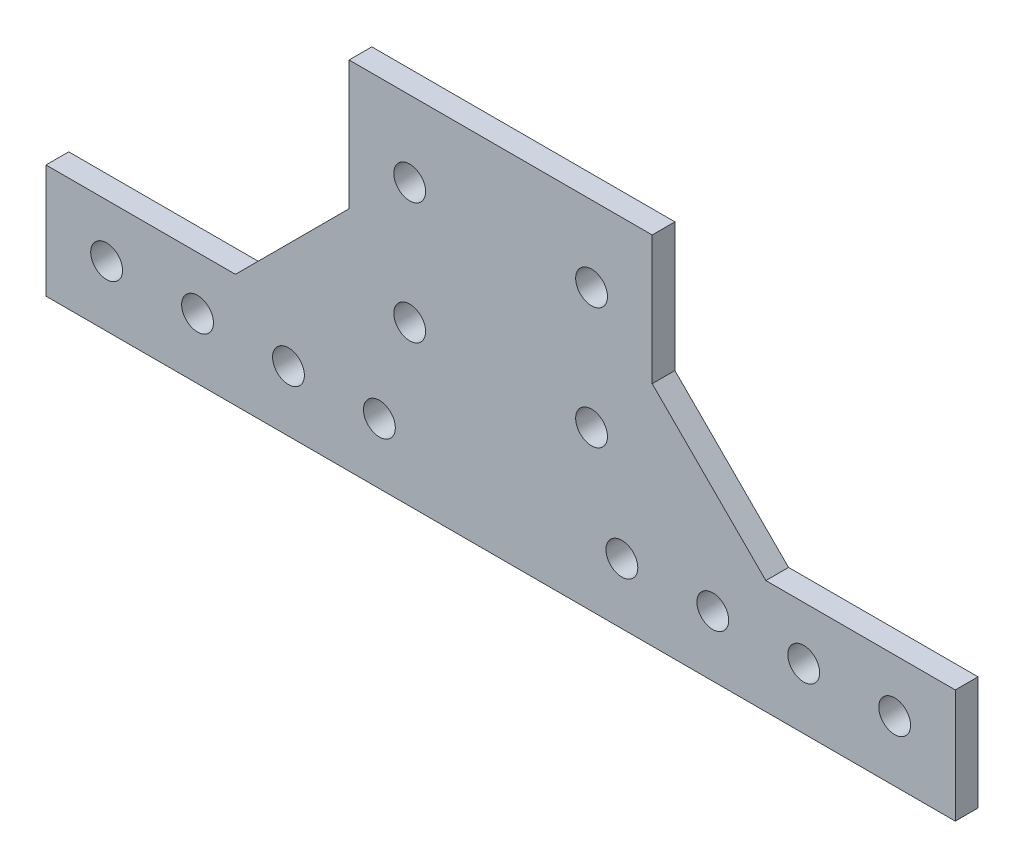
from build123d import *

# Parameters (mm, degrees)
EXTRUDE_1_DEPTH     = 3
SKETCH_2_R          = 2.1
CUT_EXTRUDE_1_DEPTH = 129.910821889


with BuildPart() as part:
    # 草图1 → 凸台-拉伸1 (new body)
    with BuildSketch(Plane.XY):
        Polygon((0, 0), (0, 15), (25, 15), (40, 30), (40, 47), (80, 47), (80, 30), (95, 15), (120, 15), (120, 0), align=None)
    extrude(amount=EXTRUDE_1_DEPTH)

    # 草图2 → 切除-拉伸1 (cut, through all)
    with BuildSketch(Plane.XY.offset(3)):
        with Locations((48, 37)):
            Circle(SKETCH_2_R)
        with Locations((72, 37)):
            Circle(SKETCH_2_R)
        with Locations((48, 21)):
            Circle(SKETCH_2_R)
        with Locations((72, 21)):
            Circle(SKETCH_2_R)
        with Locations((112, 8)):
            Circle(SKETCH_2_R)
        with Locations((76, 8)):
            Circle(SKETCH_2_R)
        with Locations((88, 8)):
            Circle(SKETCH_2_R)
        with Locations((8, 8)):
            Circle(SKETCH_2_R)
        with Locations((20, 8)):
            Circle(SKETCH_2_R)
        with Locations((100, 8)):
            Circle(SKETCH_2_R)
        with Locations((32, 8)):
            Circle(SKETCH_2_R)
        with Locations((44, 8)):
            Circle(SKETCH_2_R)
        with Locations((432, 8)):
            Circle(SKETCH_2_R)
        with Locations((444, 8)):
            Circle(SKETCH_2_R)
        with Locations((524, 8)):
            Circle(SKETCH_2_R)
        with Locations((536, 8)):
            Circle(SKETCH_2_R)
        with Locations((456, 8)):
            Circle(SKETCH_2_R)
        with Locations((468, 8)):
            Circle(SKETCH_2_R)
        with Locations((500, 8)):
            Circle(SKETCH_2_R)
        with Locations((512, 8)):
            Circle(SKETCH_2_R)
    extrude(amount=-CUT_EXTRUDE_1_DEPTH, mode=Mode.SUBTRACT)


solid = part.part
